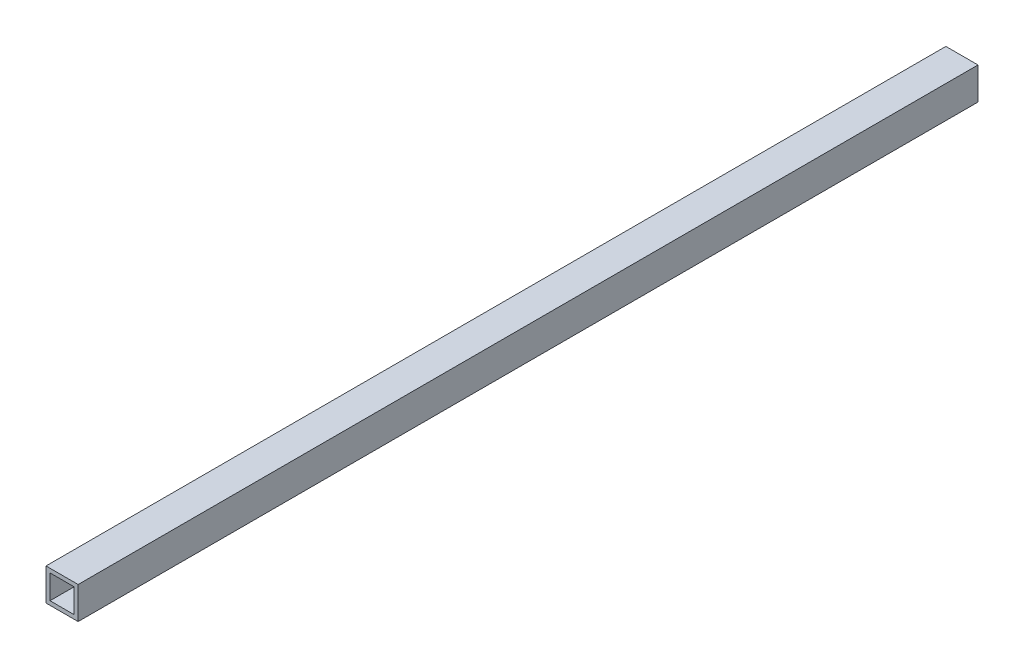
from build123d import *

# Parameters (mm, degrees)
BOSS_EXTRUDE1_DEPTH      = 355.6
BOSS_EXTRUDE1_DEPTH_BACK = 355.6
SKETCH1_W                = 25.4
SKETCH1_H                = 25.4
SKETCH1_W_2              = 19.05
SKETCH1_H_2              = 19.05


with BuildPart() as part:
    # Sketch1 → Boss-Extrude1 (new, two sides: drawn at the far end of the back side and taken through both)
    with BuildSketch(Plane.XY.offset(-BOSS_EXTRUDE1_DEPTH_BACK)):
        with Locations((330.2, 79.375)):
            Rectangle(SKETCH1_W, SKETCH1_H)
        with Locations((330.2, 79.375)):
            Rectangle(SKETCH1_W_2, SKETCH1_H_2, mode=Mode.SUBTRACT)
    extrude(amount=BOSS_EXTRUDE1_DEPTH + BOSS_EXTRUDE1_DEPTH_BACK)


solid = part.part
